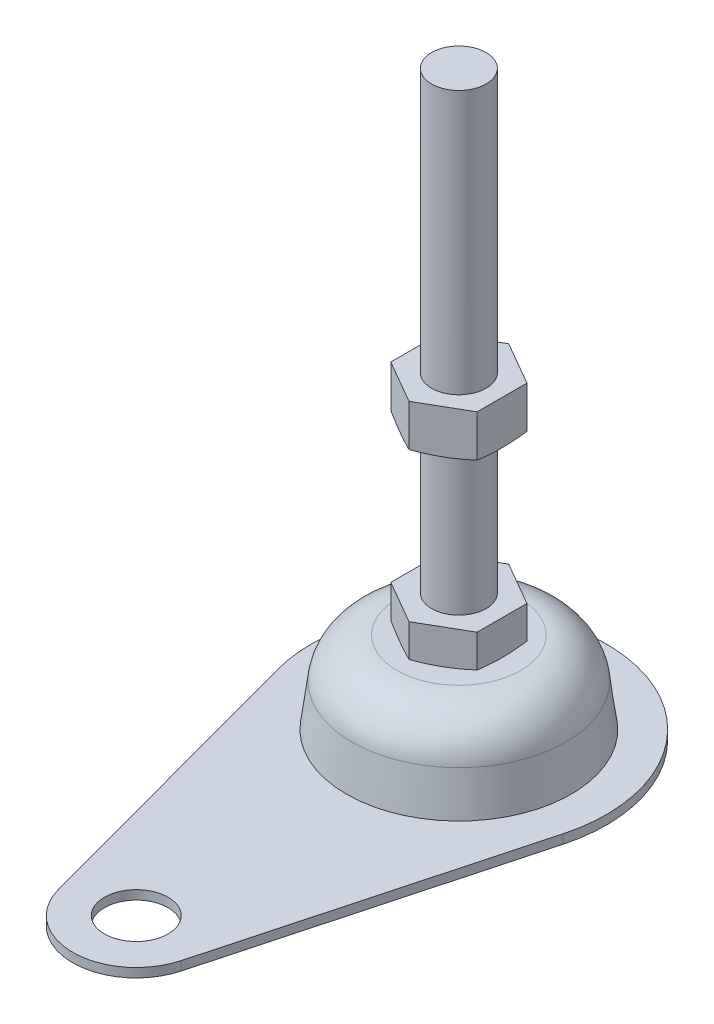
from build123d import *

# Parameters (mm, degrees)
SKETCH2_R           = 7
BOSS_EXTRUDE1_DEPTH = 2
BOSS_EXTRUDE2_DEPTH = 8
BOSS_EXTRUDE3_DEPTH = 10


with BuildPart() as part:
    # Sketch1 → Revolve1 (revolve)
    with BuildSketch(Plane.XY, mode=Mode.PRIVATE) as revolve1_sk:
        with BuildLine():
            Line((0, 0), (0, 128))
            Line((0, 128), (6, 128))
            Line((6, 128), (6, 20))
            Line((6, 20), (13.597185418, 20))
            ThreePointArc((13.597185418, 20), (20.190643569, 17.518398075), (23.511634032, 11.305261922))
            Line((23.511634032, 11.305261922), (25, 0))
            Line((25, 0), (0, 0))
        make_face()
    revolve(revolve1_sk.sketch.rotate(Axis((0, 0, 0), (0, 1, 0)), 90), axis=Axis((0, 0, 0), (0, 1, 0)))

    # Sketch2 → Boss-Extrude1 (add)
    with BuildSketch(Plane(origin=(0, 0, 0), x_dir=(1, 0, 0), z_dir=(0, 1, 0))):
        with BuildLine():
            Line((-13.516394418, -74.647887324), (-31.377344185, -8.468309859))
            ThreePointArc((-31.377344185, -8.468309859), (0, 32.5), (31.377344185, -8.468309859))
            Line((31.377344185, -8.468309859), (13.516394418, -74.647887324))
            ThreePointArc((13.516394418, -74.647887324), (0, -85), (-13.516394418, -74.647887324))
        make_face()
        with Locations(Location((0, -71, 0), (0, 0, 270))):
            Circle(SKETCH2_R, mode=Mode.SUBTRACT)
    extrude(amount=BOSS_EXTRUDE1_DEPTH)

    # Sketch3 → Boss-Extrude2 (add)
    with BuildSketch(Plane(origin=(0, 20, 0), x_dir=(1, 0, 0), z_dir=(0, 1, 0))):
        Polygon((0, -10.969655115), (9.5, -5.484827557), (9.5, 5.484827557), (0, 10.969655115), (-9.5, 5.484827557), (-9.5, -5.484827557), align=None)
    extrude(amount=BOSS_EXTRUDE2_DEPTH)

    # Sketch5 → Boss-Extrude3 (add)
    with BuildSketch(Plane(origin=(0, 70, 0), x_dir=(1, 0, 0), z_dir=(0, 1, 0))):
        Polygon((0, 10.969655115), (-9.5, 5.484827557), (-9.5, -5.484827557), (0, -10.969655115), (9.5, -5.484827557), (9.5, 5.484827557), align=None)
    extrude(amount=-BOSS_EXTRUDE3_DEPTH)

    # Sketch4 → Cut-Revolve1 (revolve, cut)
    with BuildSketch(Plane(origin=(0, 0, 0), x_dir=(0, 0, -1), z_dir=(1, 0, 0)), mode=Mode.PRIVATE) as cut_revolve1_sk:
        Polygon((8, 20), (10.969655115, 20), (10.969655115, 20.79571669), align=None)
        Polygon((8, 60), (10.969655115, 60), (10.969655115, 60.79571669), align=None)
    revolve(cut_revolve1_sk.sketch.rotate(Axis((0, 60, 0), (0, -1, 0)), 180), axis=Axis((0, 60, 0), (0, -1, 0)), mode=Mode.SUBTRACT)


solid = part.part
